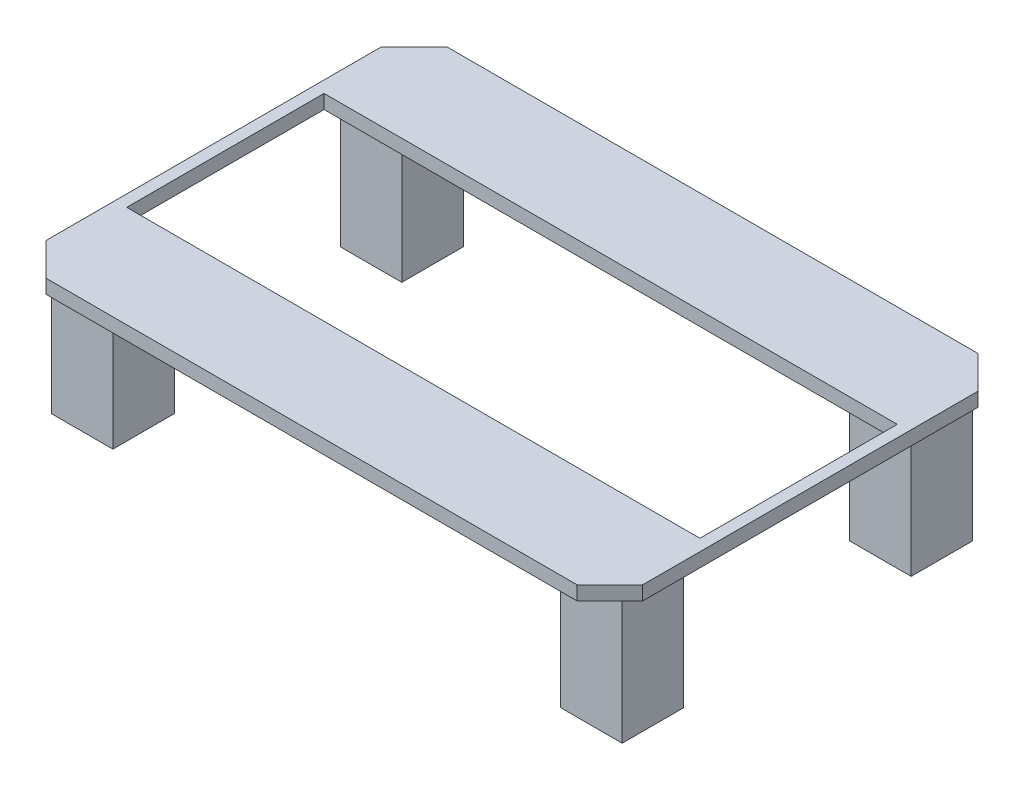
from build123d import *

# Parameters (mm, degrees)
SKETCH1_W               = 128
SKETCH1_H               = 86
BOSS_EXTRUDE1_DEPTH     = 3
CUT_EXTRUDE1_DEPTH      = 3
CUT_EXTRUDE2_DEPTH      = 3
CUT_EXTRUDE3_DEPTH      = 3
CUT_EXTRUDE4_DEPTH      = 3
SKETCH9_W               = 123
SKETCH9_H               = 42.35
CUT_EXTRUDE5_DEPTH      = 3
SKETCH23_W              = 13.2
SKETCH23_H              = 13.2
BOSS_EXTRUDE7_DEPTH     = 27
MIRROR2_COPY_1_SKETCH_W = 13.2
MIRROR2_COPY_1_SKETCH_H = 13.2
MIRROR2_COPY_1_DEPTH    = 27
SKETCH25_W              = 8.6
SKETCH25_H              = 7.1
BOSS_EXTRUDE8_DEPTH     = 3


with BuildPart() as part:
    # Sketch1 → Boss-Extrude1 (new body)
    with BuildSketch(Plane(origin=(0, 0, 0), x_dir=(1, 0, 0), z_dir=(0, 1, 0))):
        Rectangle(SKETCH1_W, SKETCH1_H)
    extrude(amount=BOSS_EXTRUDE1_DEPTH)

    # Sketch3 → Cut-Extrude1 (cut)
    with BuildSketch(Plane(origin=(0, 0, 0), x_dir=(-1, 0, 0), z_dir=(0, -1, 0))):
        Polygon((64, -43), (56.999376177, -43), (64, -35.995743323), align=None)
    extrude(amount=-CUT_EXTRUDE1_DEPTH, mode=Mode.SUBTRACT)

    # Sketch6 → Cut-Extrude2 (cut)
    with BuildSketch(Plane.XZ):
        Polygon((-64, -43), (-57, -43), (-64, -36.003281028), align=None)
    extrude(amount=-CUT_EXTRUDE2_DEPTH, mode=Mode.SUBTRACT)

    # Sketch7 → Cut-Extrude3 (cut)
    with BuildSketch(Plane.XZ):
        Polygon((64, 43), (57, 43), (64, 36), align=None)
    extrude(amount=-CUT_EXTRUDE3_DEPTH, mode=Mode.SUBTRACT)

    # Sketch8 → Cut-Extrude4 (cut)
    with BuildSketch(Plane.XZ):
        Polygon((64, -43), (64, -36), (57, -43), align=None)
    extrude(amount=-CUT_EXTRUDE4_DEPTH, mode=Mode.SUBTRACT)

    # Sketch9 → Cut-Extrude5 (cut)
    with BuildSketch(Plane.XZ):
        Rectangle(SKETCH9_W, SKETCH9_H)
    extrude(amount=-CUT_EXTRUDE5_DEPTH, mode=Mode.SUBTRACT)

    # Sketch23 → Boss-Extrude7 (add)
    with BuildSketch(Plane.XZ):
        with Locations((54.651250219, 31.000549)):
            Rectangle(SKETCH23_W, SKETCH23_H)
    boss_extrude7 = extrude(amount=BOSS_EXTRUDE7_DEPTH)

    # Mirror1: Boss-Extrude7 across plane
    add(boss_extrude7.mirror(Plane.XY))

    # Mirror2: Boss-Extrude7 across plane
    add(boss_extrude7.mirror(Plane(origin=(0, 0, 0), x_dir=(0, 0, 1), z_dir=(1, 0, 0))))

    # Mirror2 copy 1 sketch → Mirror2 copy 1 (add)
    with BuildSketch(Plane(origin=(0, 0, 0), x_dir=(-1, 0, 0), z_dir=(0, -1, 0))):
        with Locations((54.651250219, 31.000549)):
            Rectangle(MIRROR2_COPY_1_SKETCH_W, MIRROR2_COPY_1_SKETCH_H)
    extrude(amount=MIRROR2_COPY_1_DEPTH)

    # Sketch25 → Boss-Extrude8 (add)
    with BuildSketch(Plane.XZ):
        with Locations((-43.751250219, -28.035331383)):
            Rectangle(SKETCH25_W, SKETCH25_H)
    boss_extrude8 = extrude(amount=BOSS_EXTRUDE8_DEPTH)

    # Mirror4: Boss-Extrude8 across plane
    add(boss_extrude8.mirror(Plane.XY))


solid = part.part
